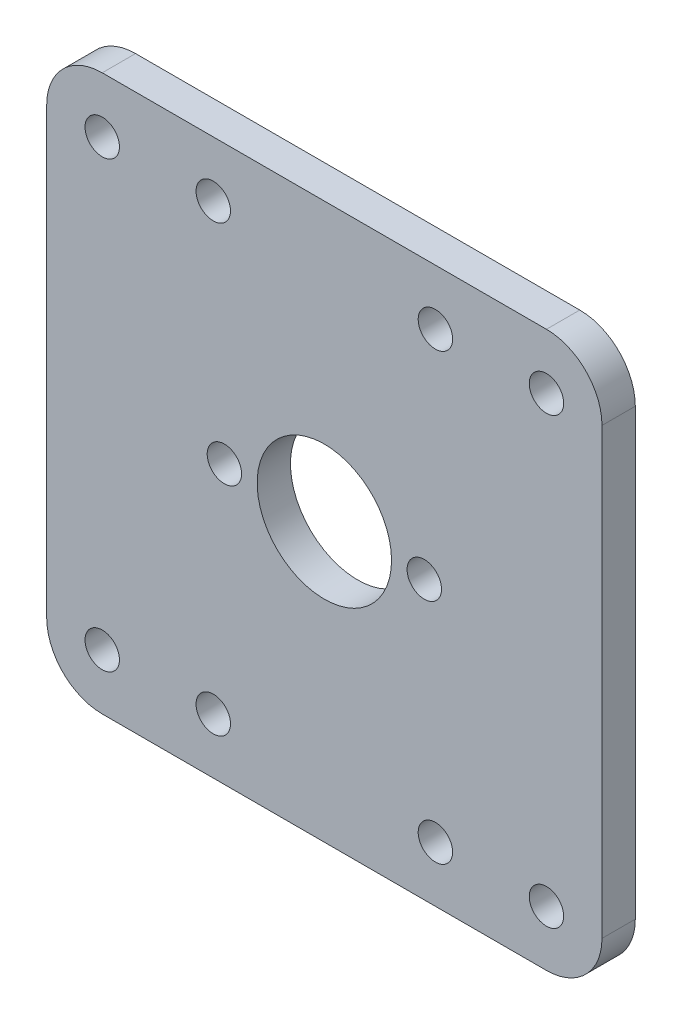
from build123d import *

# Parameters (mm, degrees)
SKETCH_1_W          = 50
SKETCH_1_H          = 50
SKETCH_1_R          = 1.55
SKETCH_1_R_2        = 6.05
EXTRUDE_1_DEPTH     = 3
FILLET_1_R          = 5
SKETCH_2_R          = 1.55
CUT_EXTRUDE_1_DEPTH = 36.482389998


with BuildPart() as part:
    # ｽｹｯﾁ1 → ﾎﾞｽ - 押し出し1 (new body)
    with BuildSketch(Plane.XY):
        Rectangle(SKETCH_1_W, SKETCH_1_H)
        with Locations((-20, 20)):
            Circle(SKETCH_1_R, mode=Mode.SUBTRACT)
        with Locations((20, 20)):
            Circle(SKETCH_1_R, mode=Mode.SUBTRACT)
        with Locations((20, -20)):
            Circle(SKETCH_1_R, mode=Mode.SUBTRACT)
        with Locations((-20, -20)):
            Circle(SKETCH_1_R, mode=Mode.SUBTRACT)
        Circle(SKETCH_1_R_2, mode=Mode.SUBTRACT)
        with Locations((-9, 0)):
            Circle(SKETCH_1_R, mode=Mode.SUBTRACT)
        with Locations(Location((9, 0, 0), (0, 0, 180))):
            Circle(SKETCH_1_R, mode=Mode.SUBTRACT)
    extrude(amount=EXTRUDE_1_DEPTH)

    # ﾌｨﾚｯﾄ1
    fillet_1_edges = [part.edges().sort_by_distance(p)[0] for p in [
        (25, -25, 1.5),
        (-25, -25, 1.5),
        (-25, 25, 1.5),
        (25, 25, 1.5),
    ]]
    fillet(fillet_1_edges, radius=FILLET_1_R)

    # ｽｹｯﾁ2 → ｶｯﾄ - 押し出し1 (cut, through all)
    with BuildSketch(Plane.XY.offset(3)):
        with Locations((-10, 20)):
            Circle(SKETCH_2_R)
        with Locations(Location((10, 20, 0), (0, 0, 180))):
            Circle(SKETCH_2_R)
        with Locations((10, -20)):
            Circle(SKETCH_2_R)
        with Locations(Location((-10, -20, 0), (0, 0, 180))):
            Circle(SKETCH_2_R)
    extrude(amount=-CUT_EXTRUDE_1_DEPTH, mode=Mode.SUBTRACT)


solid = part.part
